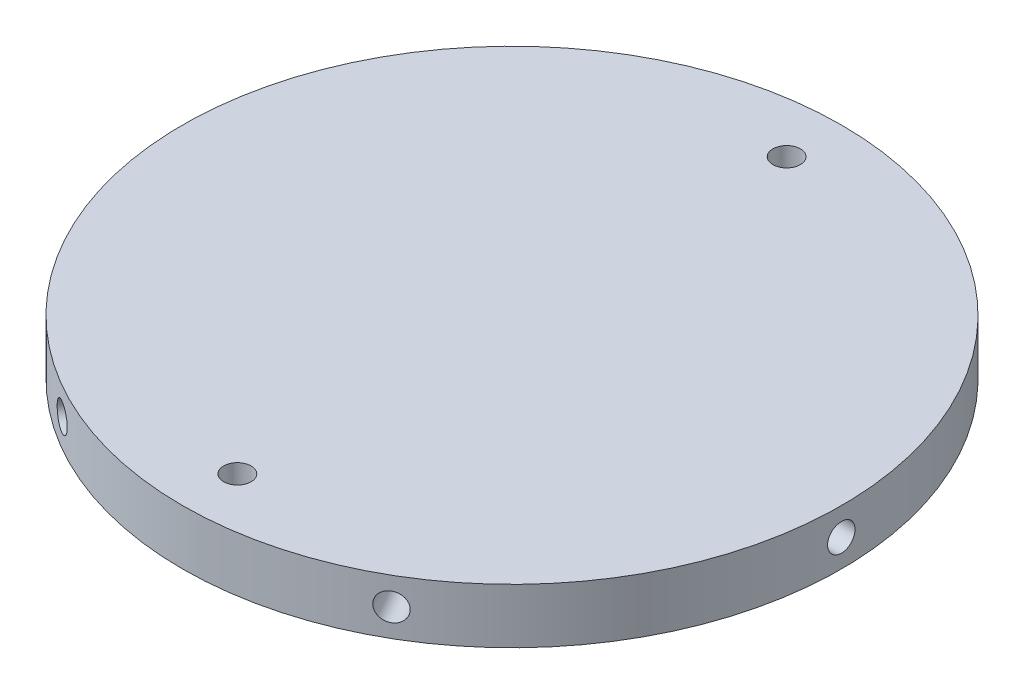
from build123d import *

# Parameters (mm, degrees)
SKETCH1_R           = 76.2
SKETCH1_R_2         = 3.175
BOSS_EXTRUDE1_DEPTH = 12.7
SKETCH2_R           = 3.175
CUT_EXTRUDE1_DEPTH  = 12.7
CIRPATTERN1_COUNT   = 6


with BuildPart() as part:
    # Sketch1 → Boss-Extrude1 (new body)
    with BuildSketch(Plane(origin=(0, 0, 0), x_dir=(1, 0, 0), z_dir=(0, 1, 0))):
        with Locations(Location((0, 0, 0), (0, 0, 270))):
            Circle(SKETCH1_R)
        with Locations(Location((0, -63.5, 0), (0, 0, 270))):
            Circle(SKETCH1_R_2, mode=Mode.SUBTRACT)
        with Locations(Location((0, 63.5, 0), (0, 0, 270))):
            Circle(SKETCH1_R_2, mode=Mode.SUBTRACT)
    extrude(amount=BOSS_EXTRUDE1_DEPTH)

    # Sketch2 → Cut-Extrude1 (cut)
    with BuildSketch(Plane(origin=(76.2, 0, 0), x_dir=(0, 0, -1), z_dir=(1, 0, 0))):
        with Locations((0, 6.35)):
            Circle(SKETCH2_R)
    cut_extrude1 = extrude(amount=-CUT_EXTRUDE1_DEPTH, mode=Mode.SUBTRACT)

    # CirPattern1: Cut-Extrude1 ×6 about axis
    cirpattern1_axis = Axis((0, 0, 0), (0, 1, 0))
    for i in range(1, CIRPATTERN1_COUNT):
        add(cut_extrude1.rotate(cirpattern1_axis, i * 360 / CIRPATTERN1_COUNT), mode=Mode.SUBTRACT)


solid = part.part
